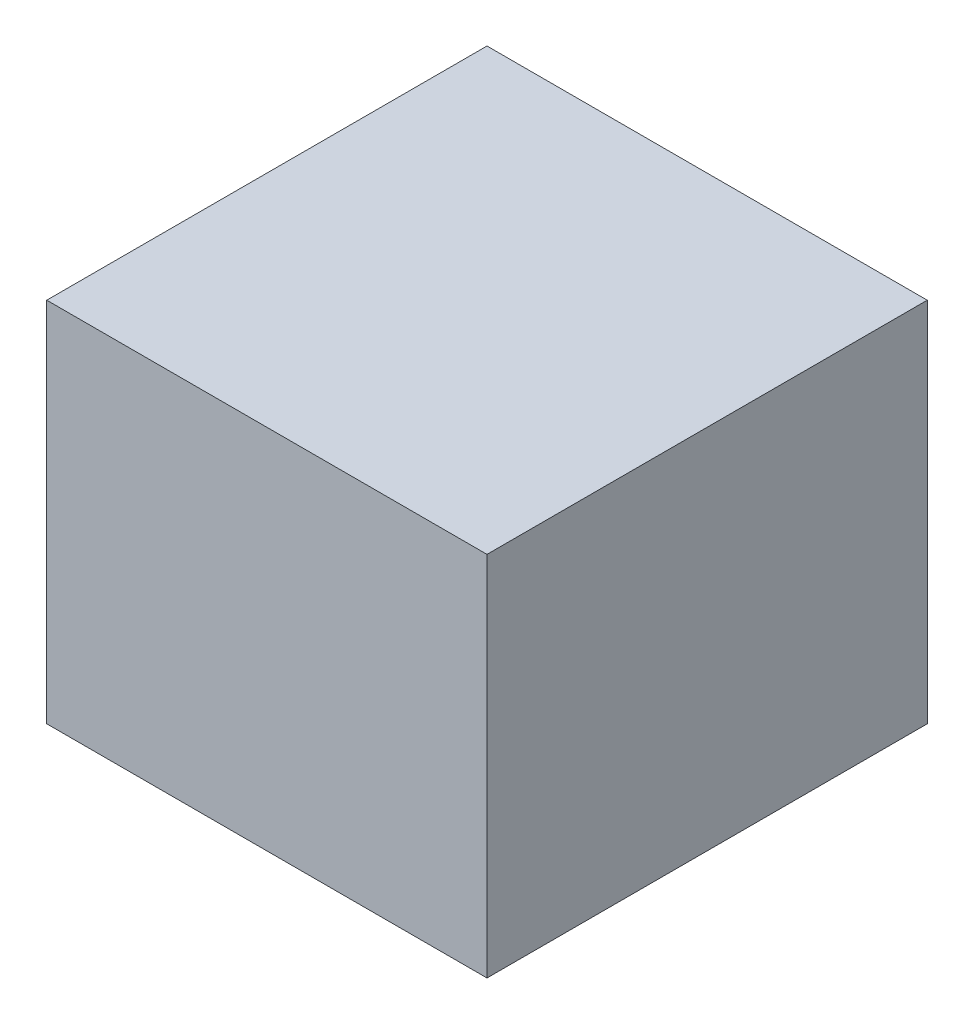
from build123d import *

# Parameters (mm, degrees)
SKETCH1_W           = 12
SKETCH1_H           = 12
BOSS_EXTRUDE1_DEPTH = 10
SKETCH2_R           = 3
CUT_EXTRUDE1_DEPTH  = 5


with BuildPart() as part:
    # Sketch1 → Boss-Extrude1 (new body)
    with BuildSketch(Plane(origin=(0, 0, 0), x_dir=(1, 0, 0), z_dir=(0, 1, 0))):
        Rectangle(SKETCH1_W, SKETCH1_H)
    extrude(amount=BOSS_EXTRUDE1_DEPTH)

    # Sketch2 → Cut-Extrude1 (cut)
    with BuildSketch(Plane.XZ):
        with Locations(Location((0, 0, 0), (0, 0, 270))):
            Circle(SKETCH2_R)
    extrude(amount=-CUT_EXTRUDE1_DEPTH, mode=Mode.SUBTRACT)


solid = part.part
